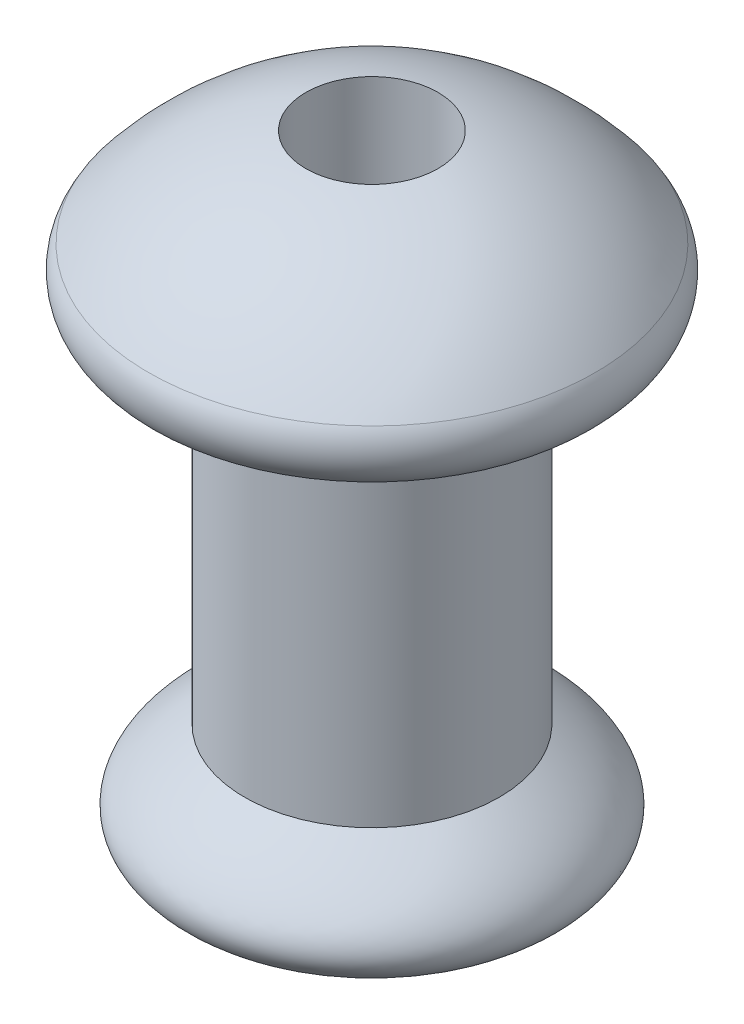
from build123d import *

# Parameters (mm, degrees)
SKETCH2_R          = 1
CUT_EXTRUDE2_DEPTH = 12.020949889


with BuildPart() as part:
    # Sketch1 → Revolve1 (revolve)
    with BuildSketch(Plane.XY, mode=Mode.PRIVATE) as revolve1_sk:
        with BuildLine():
            add(Edge.make_bspline(
                [(1.901469747, -4.187890833), (3.997803393, -5.505352851), (2.40138715, -6.003675185), (0.316595481, -6.158045679)],
                knots=[0, 0, 0, 0, 1, 1, 1, 1], degree=3))
            Line((1.901469747, -4.187890833), (1.901469747, 1.312109167))
            Line((1.901469747, 1.312109167), (3.270835138, 1.312109167))
            ThreePointArc((3.270835138, 1.312109167), (3.457066196, 1.693980285), (3.356353959, 2.106732757))
            ThreePointArc((3.356353959, 2.106732757), (3.314000681, 2.158555901), (3.270835138, 2.209704452))
            ThreePointArc((3.270835138, 2.209704452), (1.788504548, 3.318079362), (-0.024669059, 3.689832486))
            Line((-0.024669059, 3.689832486), (-0.024669059, -6.158045679))
            Line((-0.024669059, -6.158045679), (0.316595481, -6.158045679))
        make_face()
    revolve(revolve1_sk.sketch.rotate(Axis((-0.024669059, -4.1454e-05, 0), (0, -1, 0)), 180), axis=Axis((-0.024669059, -4.1454e-05, 0), (0, -1, 0)))

    # Sketch2 → Cut-Extrude2 (cut, through all)
    with BuildSketch(Plane(origin=(0, -6.158045679, 0), x_dir=(-1, 0, 0), z_dir=(0, -1, 0))):
        with Locations(Location((0.024669059, 0, 0), (0, 0, 180))):
            Circle(SKETCH2_R)
    extrude(amount=-CUT_EXTRUDE2_DEPTH, mode=Mode.SUBTRACT)


solid = part.part
